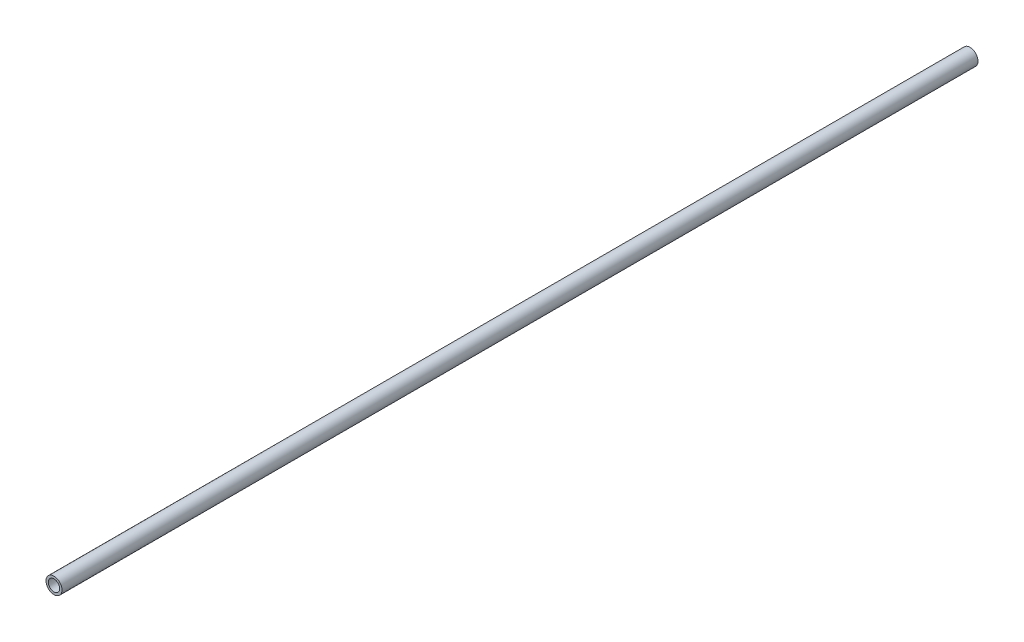
from build123d import *

# Parameters (mm, degrees)
SKETCH1_R           = 13.335
SKETCH1_R_2         = 9.4234
EXTRUDE_THIN1_DEPTH = 762


with BuildPart() as part:
    # Sketch1 → Extrude-Thin1 (new, symmetric)
    with BuildSketch(Plane.XY):
        Circle(SKETCH1_R)
        Circle(SKETCH1_R_2, mode=Mode.SUBTRACT)
    extrude(amount=EXTRUDE_THIN1_DEPTH, both=True)


solid = part.part
